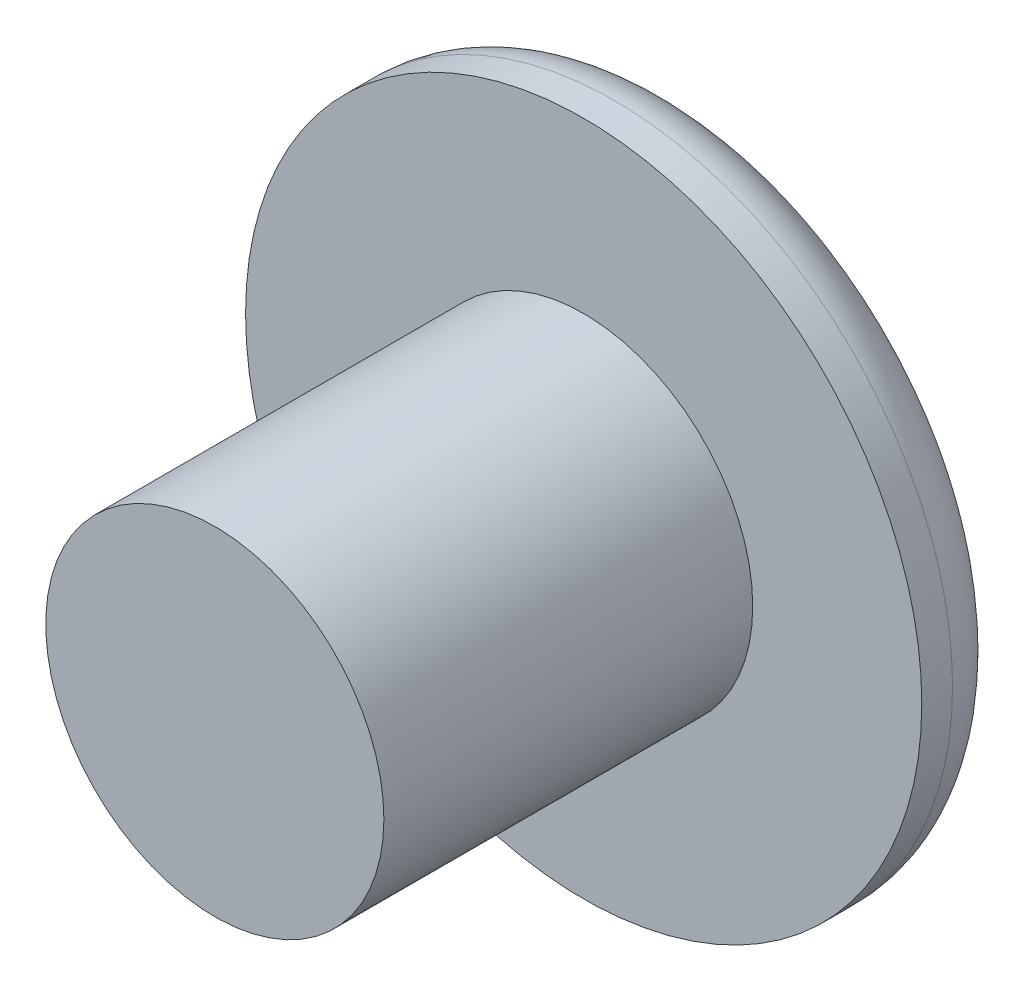
from build123d import *

# Parameters (mm, degrees)
SKETCH1_R           = 11
BOSS_EXTRUDE1_DEPTH = 3
SKETCH2_R           = 5.5
BOSS_EXTRUDE2_DEPTH = 12
FILLET2_R           = 2


with BuildPart() as part:
    # Sketch1 → Boss-Extrude1 (new body)
    with BuildSketch(Plane.XY):
        Circle(SKETCH1_R)
    extrude(amount=BOSS_EXTRUDE1_DEPTH)

    # Sketch2 → Boss-Extrude2 (add)
    with BuildSketch(Plane.XY.offset(3)):
        Circle(SKETCH2_R)
    extrude(amount=BOSS_EXTRUDE2_DEPTH)

    # Fillet2
    fillet2_edges = [part.edges().sort_by_distance(p)[0] for p in [
        (-11, 0, 0),
    ]]
    fillet(fillet2_edges, radius=FILLET2_R)


solid = part.part
